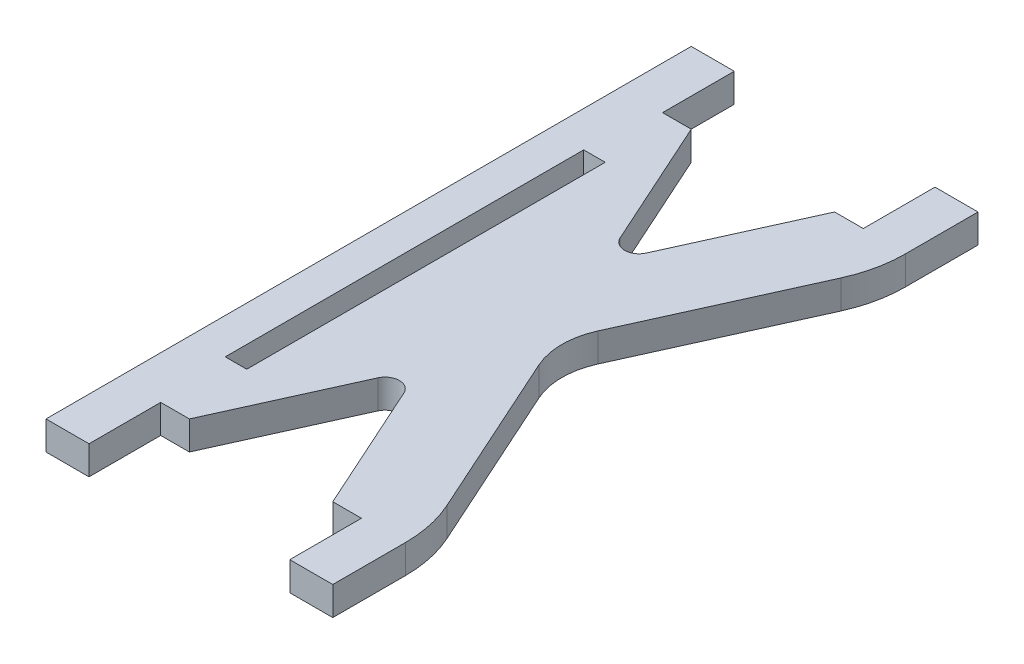
from build123d import *

# Parameters (mm, degrees)
BOSS_EXTRUDE1_DEPTH = 2
FILLET1_R           = 1
FILLET2_R           = 5
FILLET3_R           = 9
BOSS_EXTRUDE2_DEPTH = 2
SKETCH3_W           = 1.5
SKETCH3_H           = 25
CUT_EXTRUDE1_DEPTH  = 2


with BuildPart() as part:
    # Sketch1 → Boss-Extrude1 (new body)
    with BuildSketch(Plane(origin=(0, 0, 0), x_dir=(1, 0, 0), z_dir=(0, 1, 0))):
        Polygon((3, 0), (5, 0), (10, 11.071428571), (15, 0), (17, 0), (17, -5), (20, -5), (20, 0), (20, 2), (13, 17.5), (20, 33), (20, 35), (20, 40), (17, 40), (17, 35), (15, 35), (10, 23.928571429), (5, 35), (3, 35), (3, 40), (0, 40), (0, 35), (0, 33), (7, 17.5), (0, 2), (0, 0), (0, -5), (3, -5), align=None)
    extrude(amount=BOSS_EXTRUDE1_DEPTH)

    # Fillet1
    fillet1_edges = [part.edges().sort_by_distance(p)[0] for p in [
        (10, 1, -23.928571429),
        (10, 1, -11.071428571),
    ]]
    fillet(fillet1_edges, radius=FILLET1_R)

    # Fillet2
    fillet2_edges = [part.edges().sort_by_distance(p)[0] for p in [
        (7, 1, -17.5),
        (13, 1, -17.5),
    ]]
    fillet(fillet2_edges, radius=FILLET2_R)

    # Fillet3
    fillet3_edges = [part.edges().sort_by_distance(p)[0] for p in [
        (0, 1, -2),
        (0, 1, -33),
        (20, 1, -33),
        (20, 1, -2),
    ]]
    fillet(fillet3_edges, radius=FILLET3_R)

    # Sketch2 → Boss-Extrude2 (add)
    with BuildSketch(Plane(origin=(0, 2, 0), x_dir=(1, 0, 0), z_dir=(0, 1, 0))):
        Polygon((3, 35), (0, 35), (0, 0), (3, 0), (9.069161159, 17.5), align=None)
    extrude(amount=-BOSS_EXTRUDE2_DEPTH)

    # Sketch3 → Cut-Extrude1 (cut)
    with BuildSketch(Plane(origin=(0, 2, 0), x_dir=(1, 0, 0), z_dir=(0, 1, 0))):
        with Locations((3.25, 17.5)):
            Rectangle(SKETCH3_W, SKETCH3_H)
    extrude(amount=-CUT_EXTRUDE1_DEPTH, mode=Mode.SUBTRACT)


solid = part.part
